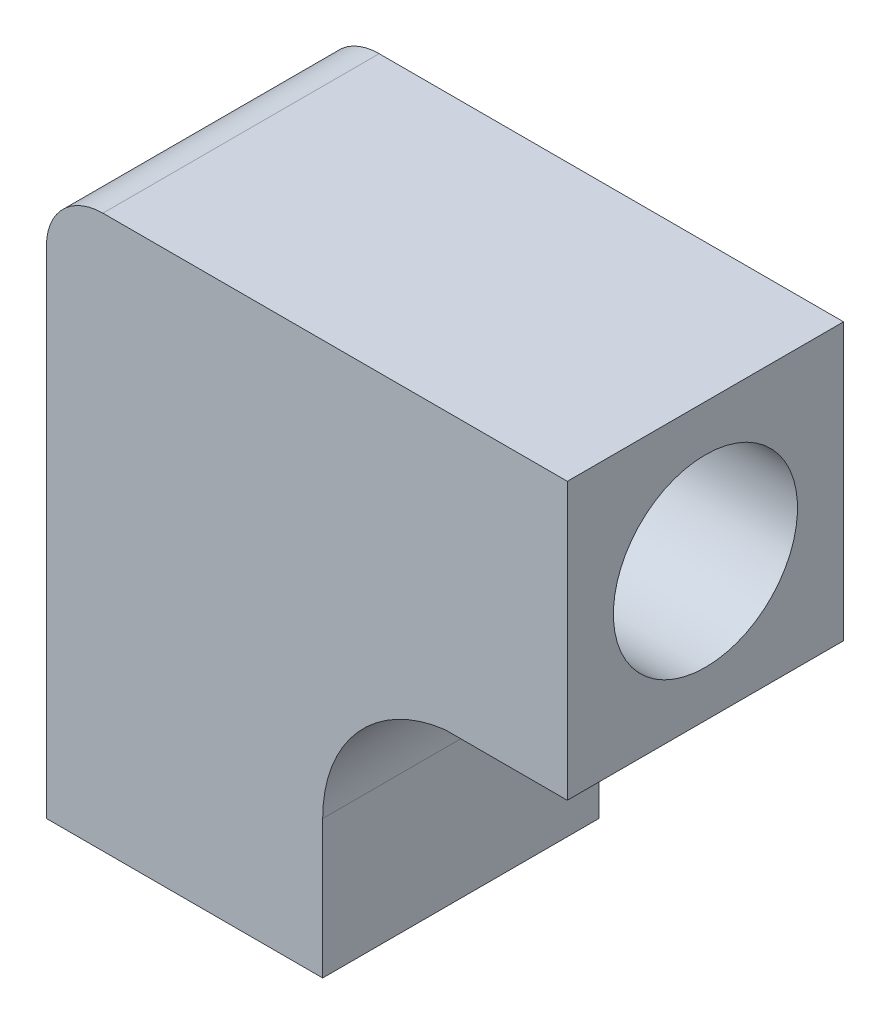
from build123d import *

# Parameters (mm, degrees)
BOSS_EXTRUDE2_DEPTH = 6
CUT_EXTRUDE6_DEPTH  = 6
CUT_EXTRUDE7_DEPTH  = 6


with BuildPart() as part:
    # Sketch1 → Boss-Extrude2 (new body)
    with BuildSketch(Plane.XY):
        with BuildLine():
            Line((-4.773172478, 12), (5.313782991, 12))
            Line((5.313782991, 12), (5.313782991, 6))
            Line((5.313782991, 6), (2.656891496, 6))
            ThreePointArc((2.656891496, 6), (0.759711241, 5.003688625), (0, 3))
            Line((0, 3), (0, 0))
            Line((0, 0), (-6, 0))
            Line((-6, 0), (-6, 10.773172478))
            ThreePointArc((-6, 10.773172478), (-5.640670538, 11.640670538), (-4.773172478, 12))
        make_face()
    extrude(amount=BOSS_EXTRUDE2_DEPTH)

    # Sketch5 → Cut-Extrude6 (cut)
    with BuildSketch(Plane(origin=(5.313782991, 0, 0), x_dir=(0, 0, -1), z_dir=(1, 0, 0))):
        with BuildLine():
            ThreePointArc((-1.585786438, 10.414213562), (-4.414213562, 10.414213562), (-4.414213562, 7.585786438))
            Line((-4.414213562, 7.585786438), (-1.585786438, 10.414213562))
        make_face()
        with BuildLine():
            Line((-1.585786438, 10.414213562), (-4.414213562, 7.585786438))
            ThreePointArc((-4.414213562, 7.585786438), (-2.234633135, 7.152240935), (-1, 9))
            ThreePointArc((-1, 9), (-1.152240935, 9.765366865), (-1.585786438, 10.414213562))
        make_face()
    extrude(amount=-CUT_EXTRUDE6_DEPTH, mode=Mode.SUBTRACT)

    # Sketch6 → Cut-Extrude7 (cut)
    with BuildSketch(Plane.XZ):
        with BuildLine():
            ThreePointArc((-1.585786438, 4.414213562), (-4.414213562, 4.414213562), (-4.414213562, 1.585786438))
            Line((-4.414213562, 1.585786438), (-1.585786438, 4.414213562))
        make_face()
        with BuildLine():
            Line((-1.585786438, 4.414213562), (-4.414213562, 1.585786438))
            ThreePointArc((-4.414213562, 1.585786438), (-2.234633135, 1.152240935), (-1, 3))
            ThreePointArc((-1, 3), (-1.152240935, 3.765366865), (-1.585786438, 4.414213562))
        make_face()
    extrude(amount=-CUT_EXTRUDE7_DEPTH, mode=Mode.SUBTRACT)


solid = part.part
